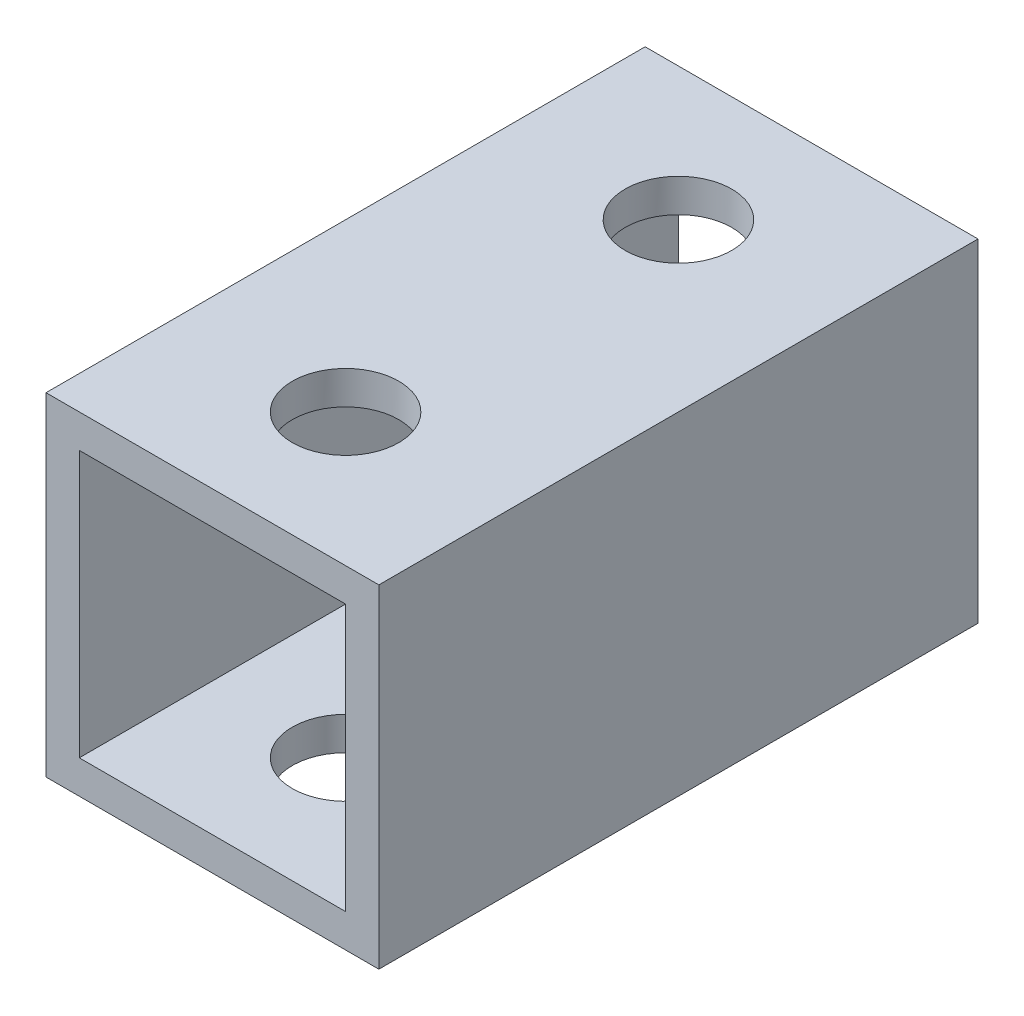
from build123d import *

# Parameters (mm, degrees)
SKETCH_282_W          = 10
SKETCH_282_H          = 10
SKETCH_282_W_2        = 8
SKETCH_282_H_2        = 8
EXTRUDE_339_DEPTH     = 18
SKETCH_411_R          = 1.6
CUT_EXTRUDE_764_DEPTH = 22.1896201


with BuildPart() as part:
    # Sketch 282 → Extrude 339 (new body)
    with BuildSketch(Plane.XY):
        Rectangle(SKETCH_282_W, SKETCH_282_H)
        Rectangle(SKETCH_282_W_2, SKETCH_282_H_2, mode=Mode.SUBTRACT)
    extrude(amount=EXTRUDE_339_DEPTH)

    # Sketch 411 → Cut-Extrude 764 (cut, through all)
    with BuildSketch(Plane(origin=(0, 5, 0), x_dir=(1, 0, 0), z_dir=(0, 1, 0))):
        with Locations(Location((0, -4, 0), (0, 0, 270))):
            Circle(SKETCH_411_R)
        with Locations(Location((0, -14, 0), (0, 0, 270))):
            Circle(SKETCH_411_R)
    extrude(amount=-CUT_EXTRUDE_764_DEPTH, mode=Mode.SUBTRACT)


solid = part.part
